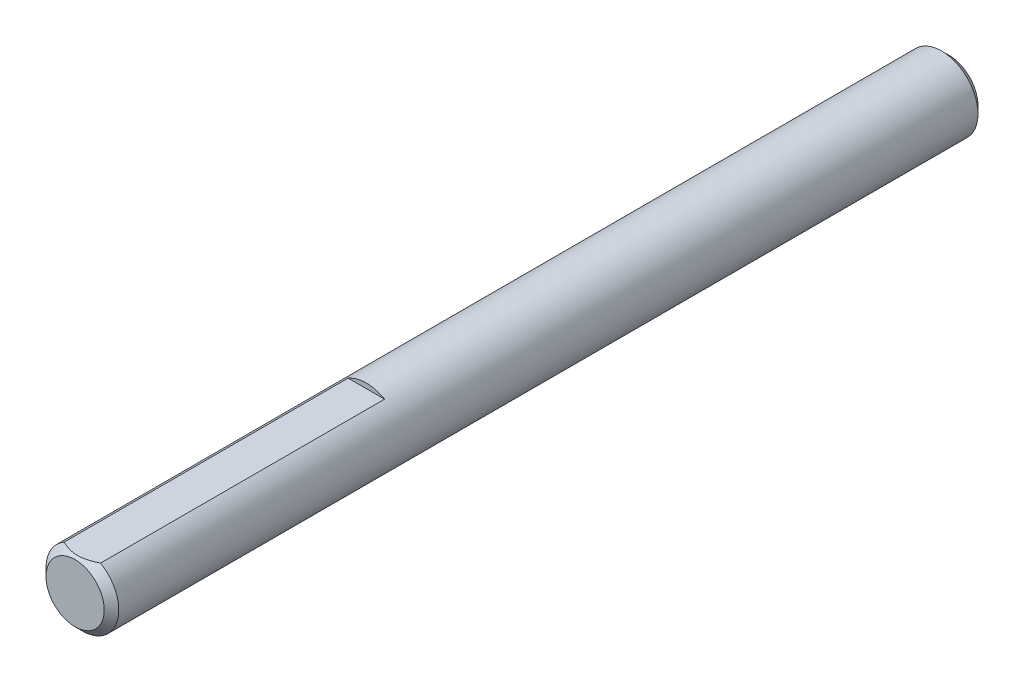
from build123d import *

# Parameters (mm, degrees)
SKETCH1_R      = 3.175
EXTRUDE1_DEPTH = 38.1
CHAMFER1_SIZE  = 0.635
EXTRUDE7_DEPTH = 51.998051433


with BuildPart() as part:
    # Sketch1 → Extrude1 (new, symmetric)
    with BuildSketch(Plane.XY):
        with Locations(Location((0, 0, 0), (0, 0, 180))):
            Circle(SKETCH1_R)
    extrude(amount=EXTRUDE1_DEPTH, both=True)

    # Chamfer1
    chamfer1_edges = [part.edges().sort_by_distance(p)[0] for p in [
        (3.175, 0, -38.1),
        (3.175, 0, 38.1),
    ]]
    chamfer(chamfer1_edges, length=CHAMFER1_SIZE)

    # Sketch13 → Extrude7 (cut, through all)
    with BuildSketch(Plane.XY.offset(12.7)):
        with BuildLine():
            Line((-1.5875, 2.749630657), (1.5875, 2.749630657))
            ThreePointArc((1.5875, 2.749630657), (0, 3.175), (-1.5875, 2.749630657))
        make_face()
    extrude(amount=EXTRUDE7_DEPTH, mode=Mode.SUBTRACT)


solid = part.part
